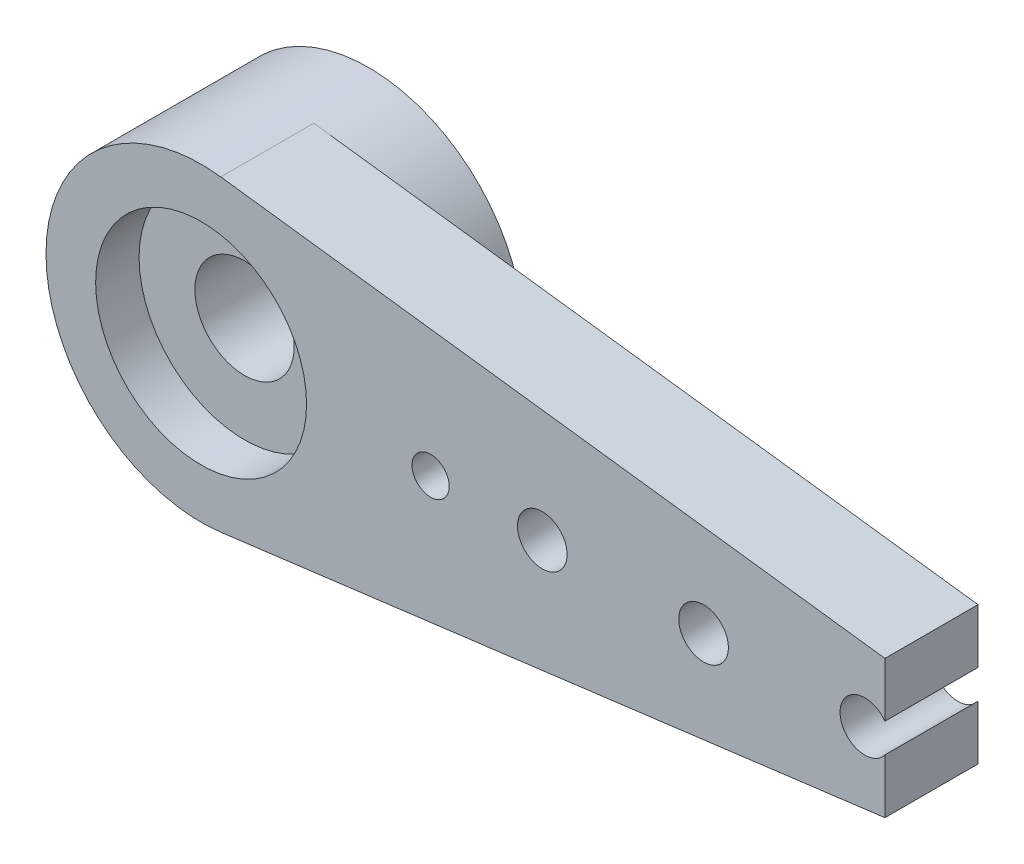
from build123d import *

# Parameters (mm, degrees)
SKETCH1_R               = 0.508
SKETCH1_R_2             = 0.381
SKETCH1_R_3             = 1.016
BOSS_EXTRUDE1_DEPTH     = 1.905
BOSS_EXTRUDE2_START     = -1.524
SKETCH1_3_R             = 3.175
SKETCH1_3_R_2           = 1.016
BOSS_EXTRUDE2_DEPTH     = 1.524
CUT_EXTRUDE1_START      = -0.889
SKETCH2_R               = 2.158999876
SKETCH2_R_2             = 1.016
CUT_EXTRUDE1_DEPTH      = 0.889
SKETCH4_R               = 2.095500003
SKETCH4_R_2             = 1.016
CUT_EXTRUDE2_DEPTH      = 0.889
CUT_EXTRUDE3_DEPTH      = 19.858264168
CUT_EXTRUDE3_DEPTH_BACK = 19.858264168
SKETCH5_R               = 0.508


with BuildPart() as part:
    # Sketch1 → Boss-Extrude1 (new body)
    with BuildSketch(Plane.XY):
        with BuildLine():
            Line((17.659400579, 0.944821475), (0.402335264, 3.149404918))
            ThreePointArc((0.402335264, 3.149404918), (-3.175, 0), (0.402335264, -3.149404918))
            Line((0.402335264, -3.149404918), (17.659400579, -0.944821475))
            ThreePointArc((17.659400579, -0.944821475), (18.4912, 0), (17.659400579, 0.944821475))
        make_face()
        with Locations((16.891, 0)):
            Circle(SKETCH1_R, mode=Mode.SUBTRACT)
        with Locations((4.699, 0)):
            Circle(SKETCH1_R_2, mode=Mode.SUBTRACT)
        with Locations((6.985, 0)):
            Circle(SKETCH1_R, mode=Mode.SUBTRACT)
        with Locations((10.287, 0)):
            Circle(SKETCH1_R, mode=Mode.SUBTRACT)
        with Locations((13.589, 0)):
            Circle(SKETCH1_R, mode=Mode.SUBTRACT)
        Circle(SKETCH1_R_3, mode=Mode.SUBTRACT)
    extrude(amount=BOSS_EXTRUDE1_DEPTH)

    # Sketch1<3> → Boss-Extrude2 (add)
    with BuildSketch(Plane.XY.offset(BOSS_EXTRUDE2_START)):
        with Locations(Location((0, 0, 0), (0, 0, 82.719918909))):
            Circle(SKETCH1_3_R)
        Circle(SKETCH1_3_R_2, mode=Mode.SUBTRACT)
    extrude(amount=BOSS_EXTRUDE2_DEPTH)

    # Sketch2 → Cut-Extrude1 (cut)
    with BuildSketch(Plane.XY.offset(1.905).offset(CUT_EXTRUDE1_START)):
        Circle(SKETCH2_R)
        Circle(SKETCH2_R_2, mode=Mode.SUBTRACT)
    extrude(amount=CUT_EXTRUDE1_DEPTH, mode=Mode.SUBTRACT)

    # Sketch4 → Cut-Extrude2 (cut)
    with BuildSketch(Plane(origin=(0, 0, -1.524), x_dir=(-1, 0, 0), z_dir=(0, 0, -1))):
        Circle(SKETCH4_R)
        Circle(SKETCH4_R_2, mode=Mode.SUBTRACT)
    extrude(amount=-CUT_EXTRUDE2_DEPTH, mode=Mode.SUBTRACT)

    # Sketch5 → Cut-Extrude3 (cut, two sides: drawn at the far end of the back side and taken through both)
    # profile 1 of 2: a face of its own
    with BuildSketch(Plane(origin=(0, 0, 0), x_dir=(-1, 0, 0), z_dir=(0, 0, -1)).offset(-CUT_EXTRUDE3_DEPTH_BACK)):
        with BuildLine():
            Line((-17.659400579, -0.944821475), (-14, -1.412308489))
            Line((-14, -1.412308489), (-14, -0.29856825))
            ThreePointArc((-14, -0.29856825), (-14.097, 0), (-14, 0.29856825))
            Line((-14, 0.29856825), (-14, 1.412308489))
            Line((-14, 1.412308489), (-17.659400579, 0.944821475))
            ThreePointArc((-17.659400579, 0.944821475), (-18.4912, 0), (-17.659400579, -0.944821475))
        make_face()
        with Locations((-16.891, 0)):
            Circle(SKETCH5_R, mode=Mode.SUBTRACT)
    # profile 2 of 2: a face of its own
    with BuildSketch(Plane(origin=(0, 0, 0), x_dir=(-1, 0, 0), z_dir=(0, 0, -1)).offset(-CUT_EXTRUDE3_DEPTH_BACK)):
        with Locations((-16.891, 0)):
            Circle(SKETCH5_R)
    extrude(amount=CUT_EXTRUDE3_DEPTH + CUT_EXTRUDE3_DEPTH_BACK, mode=Mode.SUBTRACT)


solid = part.part
